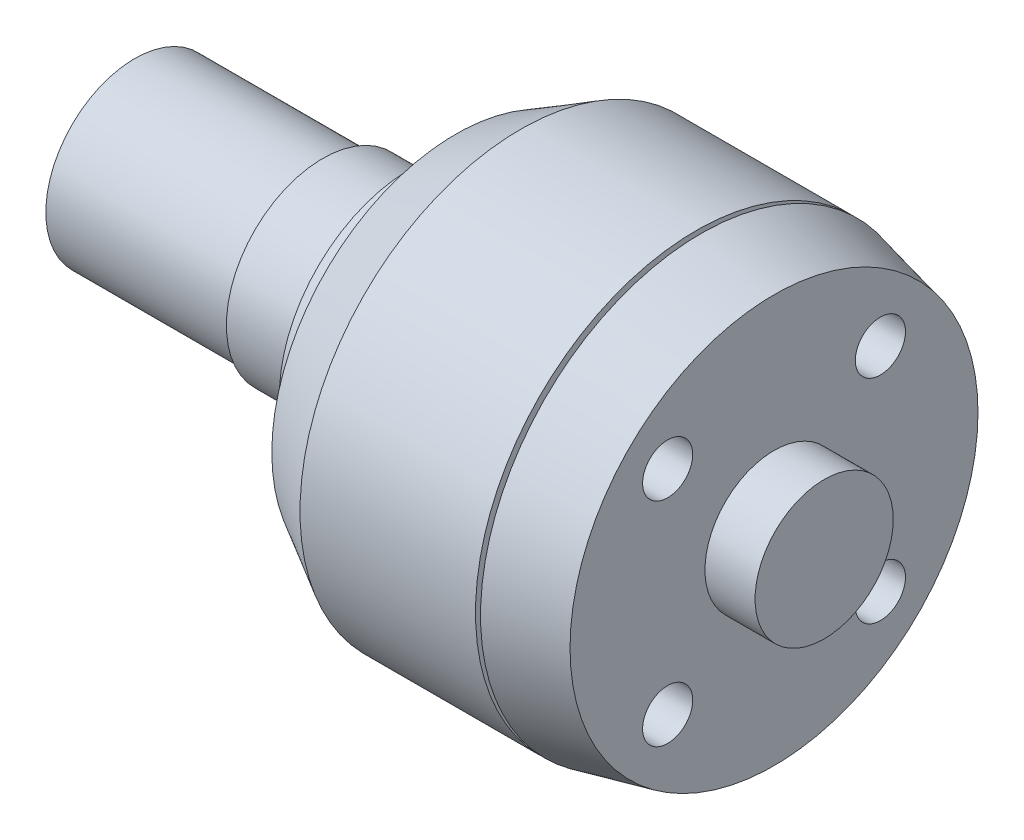
from build123d import *

# Parameters (mm, degrees)
SKETCH3_R          = 1
CUT_EXTRUDE1_DEPTH = 2


with BuildPart() as part:
    # Sketch2 → Revolve1 (revolve)
    with BuildSketch(Plane(origin=(0, 0, 0), x_dir=(1, 0, 0), z_dir=(0, 1, 0))):
        Polygon((-0.295936569, 3.843953818), (-0.295936569, 5.231399235), (1.504063431, 5.231399235), (1.504063431, 7.33120321), (4.097983636, 8.8), (11.097983636, 8.8), (11.097983636, 7.085375335), (11.297983636, 7.085375335), (11.297983636, 8.8), (14.204063431, 8.136308609), (14.204063431, 2.755066744), (16.204063431, 2.755066744), (16.204063431, 0), (-11.295936569, 0), (-11.295936569, 3.544810333), (-3.795936569, 3.544810333), (-3.795936569, 3.843953818), align=None)
    revolve(axis=Axis((16.204063431, 0, 0), (-1, 0, 0)))

    # Sketch3 → Cut-Extrude1 (cut)
    with BuildSketch(Plane(origin=(14.204063431, 0, 0), x_dir=(0, 0, -1), z_dir=(1, 0, 0))):
        with Locations((4.242640687, 4.242640687)):
            Circle(SKETCH3_R)
        with Locations((4.242640687, -4.242640687)):
            Circle(SKETCH3_R)
        with Locations((-4.242640687, -4.242640687)):
            Circle(SKETCH3_R)
        with Locations((-4.242640687, 4.242640687)):
            Circle(SKETCH3_R)
    extrude(amount=-CUT_EXTRUDE1_DEPTH, mode=Mode.SUBTRACT)


solid = part.part
